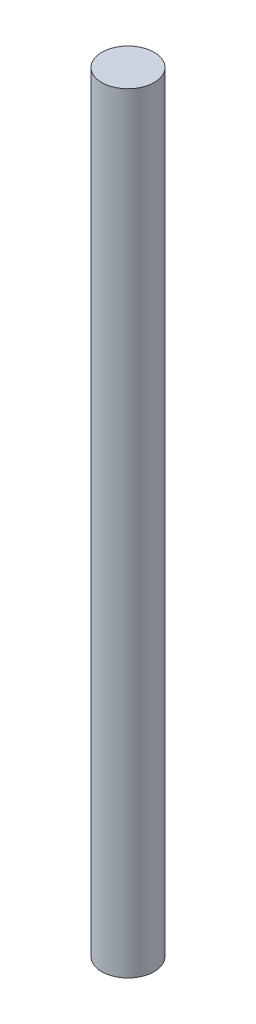
from build123d import *

# Parameters (mm, degrees)
SKETCH1_R           = 4.7625
BOSS_EXTRUDE1_DEPTH = 140
SKETCH9_R           = 1.55
CUT_EXTRUDE1_DEPTH  = 9.2


with BuildPart() as part:
    # Sketch1 → Boss-Extrude1 (new body)
    with BuildSketch(Plane(origin=(0, 0, 0), x_dir=(1, 0, 0), z_dir=(0, 1, 0))):
        with Locations(Location((0, 0, 0), (0, 0, 270))):
            Circle(SKETCH1_R)
    extrude(amount=BOSS_EXTRUDE1_DEPTH)

    # Sketch9 → Cut-Extrude1 (cut)
    with BuildSketch(Plane.XZ):
        with Locations(Location((0, 0, 0), (0, 0, 270))):
            Circle(SKETCH9_R)
    extrude(amount=-CUT_EXTRUDE1_DEPTH, mode=Mode.SUBTRACT)


solid = part.part
